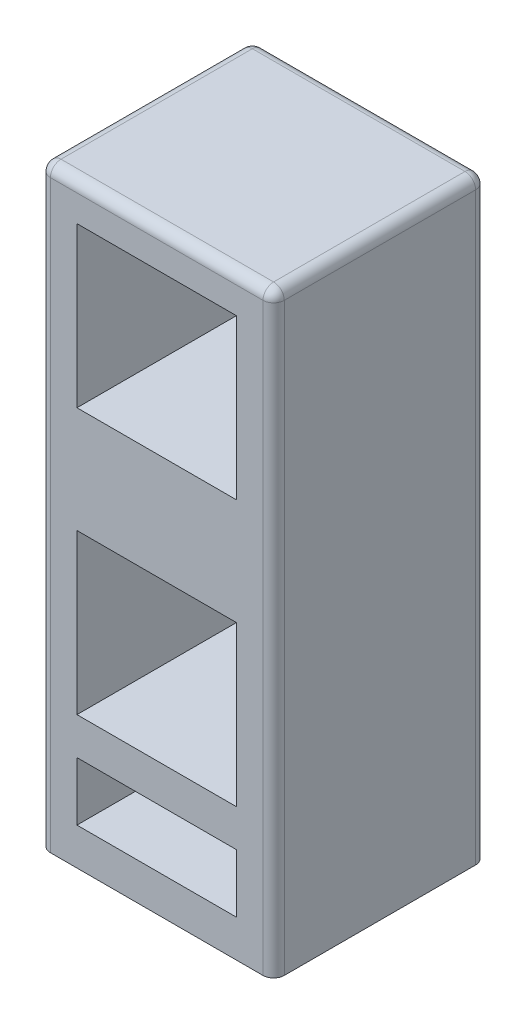
from build123d import *

# Parameters (mm, degrees)
SKETCH1_W           = 22
SKETCH1_H           = 56
SKETCH1_W_2         = 15
SKETCH1_H_2         = 15
BOSS_EXTRUDE1_DEPTH = 20
SKETCH2_W           = 15
SKETCH2_H           = 15
SKETCH2_H_2         = 5.5
CUT_EXTRUDE1_DEPTH  = 15.5
FILLET1_R           = 1


with BuildPart() as part:
    # Sketch1 → Boss-Extrude1 (new body)
    with BuildSketch(Plane.XY):
        with Locations((-14.096172604, 14.333947726)):
            Rectangle(SKETCH1_W, SKETCH1_H)
        with Locations((-14.096172604, 31.333947726)):
            Rectangle(SKETCH1_W_2, SKETCH1_H_2, mode=Mode.SUBTRACT)
    extrude(amount=BOSS_EXTRUDE1_DEPTH)

    # Sketch2 → Cut-Extrude1 (cut)
    with BuildSketch(Plane.XY.offset(20)):
        with Locations((-14.096172604, 6.333947726)):
            Rectangle(SKETCH2_W, SKETCH2_H)
        with Locations((-14.096172604, -7.416052274)):
            Rectangle(SKETCH2_W, SKETCH2_H_2)
    extrude(amount=-CUT_EXTRUDE1_DEPTH, mode=Mode.SUBTRACT)

    # Fillet1
    fillet1_edges = [part.edges().sort_by_distance(p)[0] for p in [
        (-3.096172604, 14.333947726, 20),
        (-14.096172604, 42.333947726, 20),
        (-25.096172604, 14.333947726, 20),
        (-14.096172604, 42.333947726, 0),
        (-3.096172604, 14.333947726, 0),
        (-25.096172604, 14.333947726, 0),
        (-25.096172604, 42.333947726, 10),
        (-3.096172604, 42.333947726, 10),
    ]]
    fillet(fillet1_edges, radius=FILLET1_R)


solid = part.part
